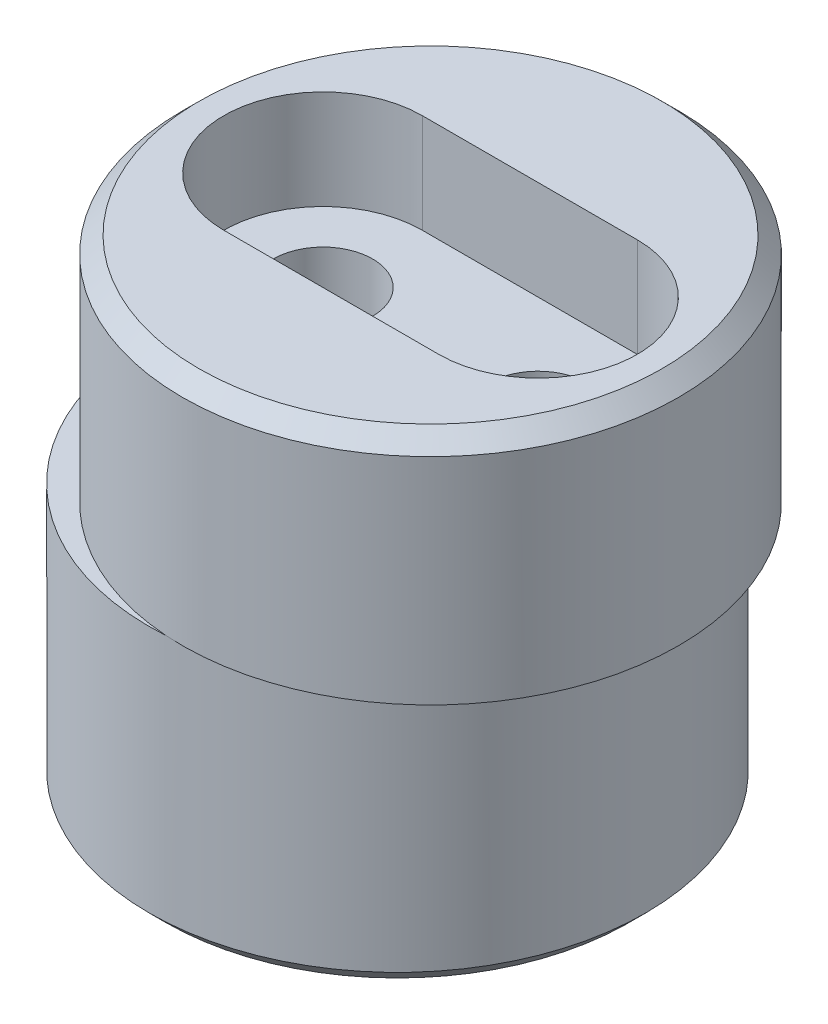
from build123d import *

# Parameters (mm, degrees)
SKETCH1_R           = 7.5
BOSS_EXTRUDE1_DEPTH = 8
SKETCH2_R           = 7.5
BOSS_EXTRUDE2_DEPTH = 7
SKETCH3_R           = 1.5
CUT_EXTRUDE1_DEPTH  = 19.801595677
CUT_EXTRUDE3_DEPTH  = 3
CHAMFER1_SIZE       = 0.5


with BuildPart() as part:
    # Sketch1 → Boss-Extrude1 (new body)
    with BuildSketch(Plane(origin=(0, 0, 0), x_dir=(1, 0, 0), z_dir=(0, 1, 0))):
        with Locations(Location((0, 0, 0), (0, 0, 270))):
            Circle(SKETCH1_R)
    extrude(amount=BOSS_EXTRUDE1_DEPTH)

    # Sketch2 → Boss-Extrude2 (add)
    with BuildSketch(Plane(origin=(0, 8, 0), x_dir=(1, 0, 0), z_dir=(0, 1, 0))):
        with Locations(Location((1, 0, 0), (0, 0, 93.822553729))):
            Circle(SKETCH2_R)
    extrude(amount=BOSS_EXTRUDE2_DEPTH)

    # Sketch3 → Cut-Extrude1 (cut, through all)
    with BuildSketch(Plane(origin=(0, 15, 0), x_dir=(1, 0, 0), z_dir=(0, 1, 0))):
        with Locations(Location((-2.25, 0, 0), (0, 0, 270))):
            Circle(SKETCH3_R)
        with Locations(Location((4.25, 0, 0), (0, 0, 270))):
            Circle(SKETCH3_R)
    extrude(amount=-CUT_EXTRUDE1_DEPTH, mode=Mode.SUBTRACT)

    # Sketch5 → Cut-Extrude3 (cut)
    with BuildSketch(Plane(origin=(0, 15, 0), x_dir=(1, 0, 0), z_dir=(0, 1, 0))):
        with BuildLine():
            Line((-2.25, 3), (4.25, 3))
            ThreePointArc((4.25, 3), (7.25, 0), (4.25, -3))
            Line((4.25, -3), (-2.25, -3))
            ThreePointArc((-2.25, -3), (-5.25, 0), (-2.25, 3))
        make_face()
    extrude(amount=-CUT_EXTRUDE3_DEPTH, mode=Mode.SUBTRACT)

    # Chamfer1
    chamfer1_edges = [part.edges().sort_by_distance(p)[0] for p in [
        (0, 0, -7.5),
        (1.5, 15, 7.483314774),
    ]]
    chamfer(chamfer1_edges, length=CHAMFER1_SIZE)


solid = part.part
